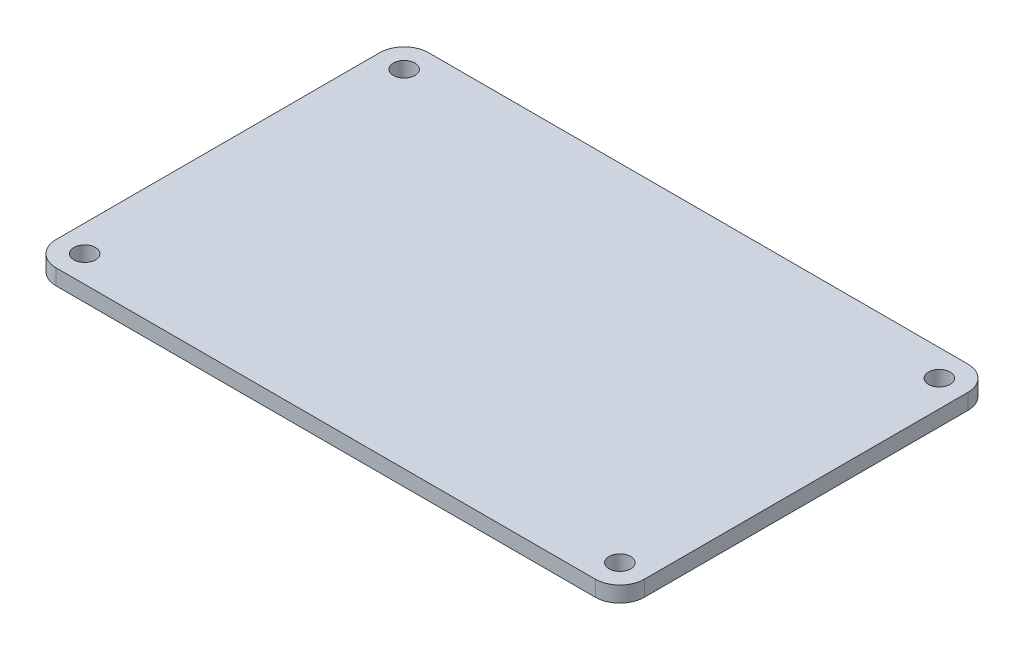
from build123d import *

# Parameters (mm, degrees)
BOSS_EXTRUDE1_DEPTH = 1.6
SKETCH2_R           = 1.1
CUT_EXTRUDE1_DEPTH  = 36.546589147


with BuildPart() as part:
    # Sketch1 → Boss-Extrude1 (new body)
    with BuildSketch(Plane(origin=(0, 0, 0), x_dir=(1, 0, 0), z_dir=(0, 1, 0))):
        with BuildLine():
            Line((-27.5, 19), (27.5, 19))
            ThreePointArc((27.5, 19), (29.267766953, 18.267766953), (30, 16.5))
            Line((30, 16.5), (30, -16.5))
            ThreePointArc((30, -16.5), (29.267766953, -18.267766953), (27.5, -19))
            Line((27.5, -19), (-27.5, -19))
            ThreePointArc((-27.5, -19), (-29.267766953, -18.267766953), (-30, -16.5))
            Line((-30, -16.5), (-30, 16.5))
            ThreePointArc((-30, 16.5), (-29.267766953, 18.267766953), (-27.5, 19))
        make_face()
    extrude(amount=BOSS_EXTRUDE1_DEPTH)

    # Sketch2 → Cut-Extrude1 (cut, through all)
    with BuildSketch(Plane(origin=(0, 1.6, 0), x_dir=(1, 0, 0), z_dir=(0, 1, 0))):
        with Locations(Location((-27.29, 16.29, 0), (0, 0, 270))):
            Circle(SKETCH2_R)
        with Locations(Location((27.29, 16.29, 0), (0, 0, 270))):
            Circle(SKETCH2_R)
        with Locations(Location((27.29, -16.29, 0), (0, 0, 270))):
            Circle(SKETCH2_R)
        with Locations(Location((-27.29, -16.29, 0), (0, 0, 270))):
            Circle(SKETCH2_R)
    extrude(amount=-CUT_EXTRUDE1_DEPTH, mode=Mode.SUBTRACT)


solid = part.part
